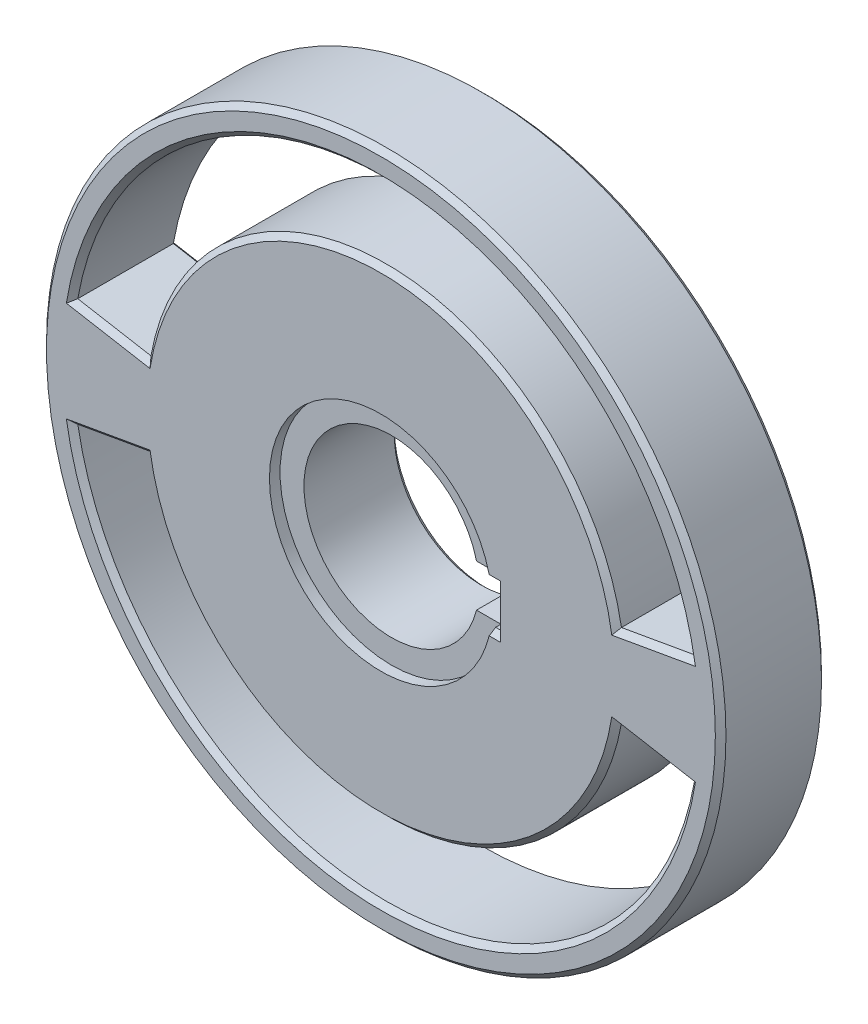
from build123d import *

# Parameters (mm, degrees)
SKETCH_1_R          = 32
EXTRUDE_1_DEPTH     = 10
SKETCH_2_R          = 8.25
CUT_EXTRUDE_1_DEPTH = 10
SKETCH_4_W          = 2.746324374
SKETCH_4_H          = 4.000918907
CUT_EXTRUDE_3_DEPTH = 10
CUT_EXTRUDE_4_DEPTH = 10
CUT_EXTRUDE_5_DEPTH = 10
CHAMFER_1_SIZE      = 0.5
CHAMFER_2_SIZE      = 0.5
SKETCH_7_R          = 10.5
CUT_EXTRUDE_6_DEPTH = 1


with BuildPart() as part:
    # 草图1 → 凸台-拉伸1 (new body)
    with BuildSketch(Plane.XY):
        Circle(SKETCH_1_R)
    extrude(amount=EXTRUDE_1_DEPTH)

    # 草图2 → 切除-拉伸1 (cut)
    with BuildSketch(Plane.XY):
        Circle(SKETCH_2_R)
    extrude(amount=CUT_EXTRUDE_1_DEPTH, mode=Mode.SUBTRACT)

    # 草图4 → 切除-拉伸3 (cut)
    with BuildSketch(Plane.XY):
        with Locations((9.376837813, -0.000459453)):
            Rectangle(SKETCH_4_W, SKETCH_4_H)
    extrude(amount=CUT_EXTRUDE_3_DEPTH, mode=Mode.SUBTRACT)

    # 草图5 → 切除-拉伸4 (cut)
    with BuildSketch(Plane.XY):
        with BuildLine():
            Line((-22.1582, 3.9071), (-29.0518, 5.1226))
            ThreePointArc((-29.0518, 5.1226), (0, 29.5), (29.0518, 5.1226))
            Line((29.0518, 5.1226), (22.1582, 3.9071))
            ThreePointArc((22.1582, 3.9071), (0, 22.5), (-22.1582, 3.9071))
        make_face()
    extrude(amount=CUT_EXTRUDE_4_DEPTH, mode=Mode.SUBTRACT)

    # 草图6 → 切除-拉伸5 (cut)
    with BuildSketch(Plane.XY):
        with BuildLine():
            Line((22.1582, -3.9071), (29.0518, -5.1226))
            ThreePointArc((29.0518, -5.1226), (0, -29.5), (-29.0518, -5.1226))
            Line((-29.0518, -5.1226), (-22.1582, -3.9071))
            ThreePointArc((-22.1582, -3.9071), (0, -22.5), (22.1582, -3.9071))
        make_face()
    extrude(amount=CUT_EXTRUDE_5_DEPTH, mode=Mode.SUBTRACT)

    # 倒角1
    chamfer_1_edges = [part.edges().sort_by_distance(p)[0] for p in [
        (9.376952648, 2, 10),
        (9.376837813, -2.000918907, 10),
        (10.75, -0.000459453, 10),
        (0, 22.5, 10),
        (25.605, 4.51485, 10),
        (0, 29.5, 10),
        (-25.605, 4.51485, 10),
        (0, -22.5, 10),
        (-32, 0, 10),
        (-25.605, -4.51485, 10),
        (0, -29.5, 10),
        (25.605, -4.51485, 10),
        (-8.249999986, 0.000473587, 10),
    ]]
    chamfer(chamfer_1_edges, length=CHAMFER_1_SIZE)

    # 倒角2
    chamfer_2_edges = [part.edges().sort_by_distance(p)[0] for p in [
        (9.376837813, -2.000918907, 0),
        (10.75, -0.000459453, 0),
        (9.376952648, 2, 0),
        (-32, 0, 0),
        (0, 22.5, 0),
        (25.605, 4.51485, 0),
        (0, 29.5, 0),
        (-25.605, 4.51485, 0),
        (0, -22.5, 0),
        (-25.605, -4.51485, 0),
        (0, -29.5, 0),
        (25.605, -4.51485, 0),
        (-8.249999986, 0.000473587, 0),
    ]]
    chamfer(chamfer_2_edges, length=CHAMFER_2_SIZE)

    # 草图7 → 切除-拉伸6 (cut)
    with BuildSketch(Plane.XY.offset(10)):
        Circle(SKETCH_7_R)
    extrude(amount=-CUT_EXTRUDE_6_DEPTH, mode=Mode.SUBTRACT)


solid = part.part
